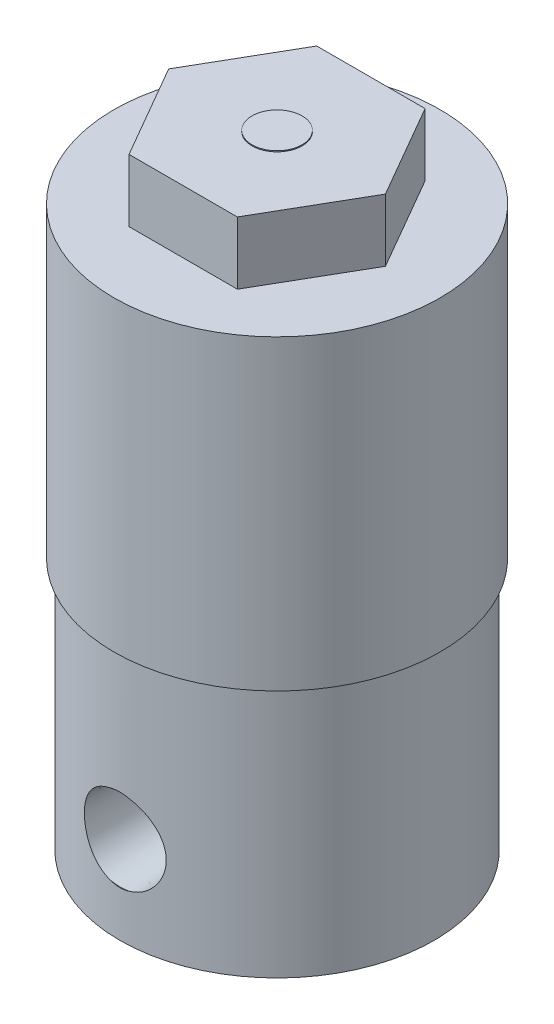
from build123d import *

# Parameters (mm, degrees)
ESQUISSE1_R               = 12.56
BOSS_EXTRU_1_DEPTH        = 20.19
ESQUISSE13_R              = 2
BOSS_EXTRU_2_DEPTH        = 29.59
ESQUISSE14_R              = 13.03
BOSS_EXTRU_3_DEPTH        = 24.51
BOSS_EXTRU_4_DEPTH        = 5
D_GAGEMENT_81_D           = 4.4958
D_GAGEMENT_81_DEPTH       = 8.649325414
D_GAGEMENT_81_CSINK_D     = 5.7658
D_GAGEMENT_81_CSINK_ANGLE = 90
D_GAGEMENT_81_TIP         = 1.350674586


with BuildPart() as part:
    # Esquisse1 → Boss.-Extru.1 (new body)
    with BuildSketch(Plane(origin=(0, 0, 0), x_dir=(1, 0, 0), z_dir=(0, 1, 0))):
        with Locations(Location((0, 0, 0), (0, 0, 270))):
            Circle(ESQUISSE1_R)
    extrude(amount=BOSS_EXTRU_1_DEPTH)

    # Esquisse9 → Trou taraudé 1/8 Rc1 (revolve, cut)
    with BuildSketch(Plane(origin=(0, 6.96, 12.56), x_dir=(0, -1, 0), z_dir=(1, 0, 0))):
        Polygon((0, 0), (0, 10.873399445), (3.95, 8.5), (3.95, 7.4), (3.05277742, 7.4), (3.283, 0.025), (3.308, 0), align=None)
    revolve(axis=Axis((0, 6.96, 18.91), (0, 0, -1)), mode=Mode.SUBTRACT)

    # Esquisse12 → Trou taraudé 1/8 Rc2 (revolve, cut)
    with BuildSketch(Plane(origin=(0, 6.949571946, -12.56), x_dir=(0, 1, 0), z_dir=(1, 0, 0))):
        Polygon((0, 0), (0, 10.873399445), (3.95, 8.5), (3.95, 7.4), (3.05277742, 7.4), (3.283, 0.025), (3.308, 0), align=None)
    revolve(axis=Axis((0, 6.949571946, -18.91), (0, 0, 1)), mode=Mode.SUBTRACT)

    # Esquisse13 → Boss.-Extru.2 (add)
    with BuildSketch(Plane(origin=(0, 20.19, 0), x_dir=(1, 0, 0), z_dir=(0, 1, 0))):
        with Locations(Location((0, 0, 0), (0, 0, 270))):
            Circle(ESQUISSE13_R)
    extrude(amount=BOSS_EXTRU_2_DEPTH)

    # Esquisse14 → Boss.-Extru.3 (add)
    with BuildSketch(Plane(origin=(0, 20.19, 0), x_dir=(1, 0, 0), z_dir=(0, 1, 0))):
        with Locations(Location((0, 0, 0), (0, 0, 270))):
            Circle(ESQUISSE14_R)
    extrude(amount=BOSS_EXTRU_3_DEPTH)

    # Esquisse16 → Boss.-Extru.4 (add)
    with BuildSketch(Plane(origin=(0, 44.7, 0), x_dir=(1, 0, 0), z_dir=(0, 1, 0))):
        Polygon((8.660254038, 0), (4.330127019, 7.5), (-4.330127019, 7.5), (-8.660254038, 0), (-4.330127019, -7.5), (4.330127019, -7.5), align=None)
    extrude(amount=BOSS_EXTRU_4_DEPTH)

    # Dégagement #81
    with Locations(Plane(origin=(-9.335, 0, 0), x_dir=(0, 0, -1), z_dir=(0, -1, 0))):
        with Locations((0, 0), (0, 18.67)):
            CounterSinkHole(D_GAGEMENT_81_D / 2, D_GAGEMENT_81_CSINK_D / 2, depth=D_GAGEMENT_81_DEPTH, counter_sink_angle=D_GAGEMENT_81_CSINK_ANGLE)
            with Locations((0, 0, -(D_GAGEMENT_81_DEPTH + D_GAGEMENT_81_TIP / 2))):  # 118° drill point
                Cone(0, D_GAGEMENT_81_D / 2, D_GAGEMENT_81_TIP, mode=Mode.SUBTRACT)


solid = part.part
